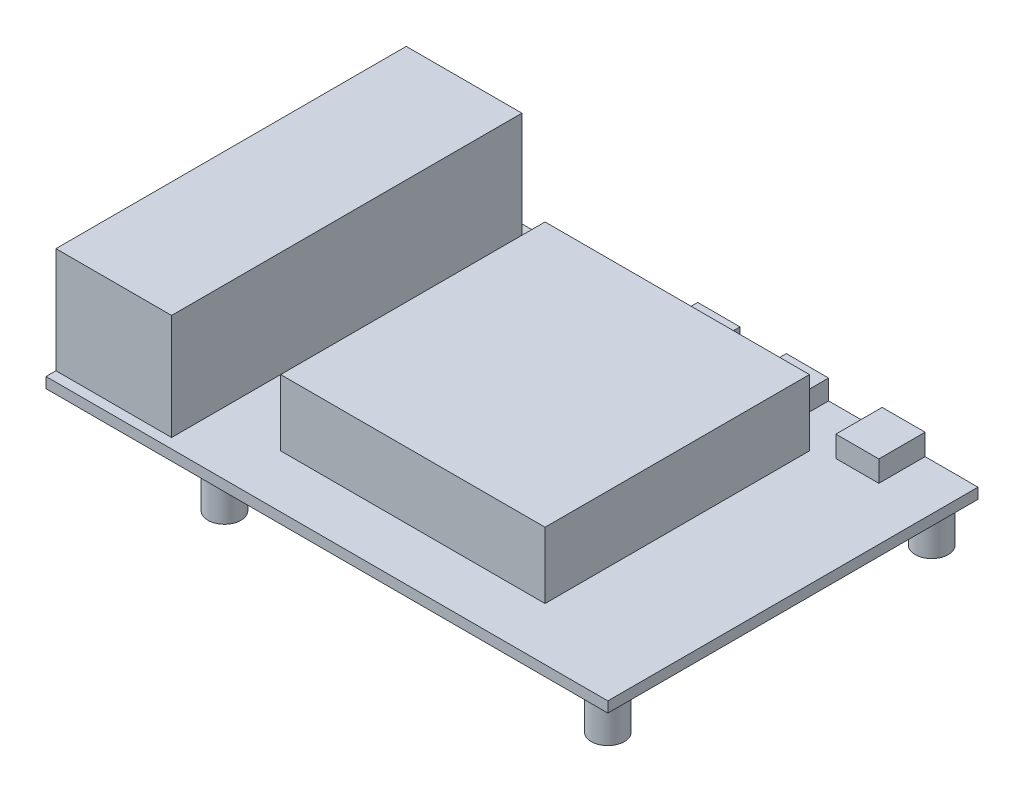
from build123d import *

# Parameters (mm, degrees)
SK_P01_STANDOFF_R        = 2.5
P01_STANDOFF_DEPTH       = 6
SK_P02_STANDOFF_R        = 2.5
P02_STANDOFF_DEPTH       = 6
SK_P03_STANDOFF_R        = 2.5
P03_STANDOFF_DEPTH       = 6
SK_P04_STANDOFF_R        = 2.5
P04_STANDOFF_DEPTH       = 6
P05_BOARD_START          = 6
SK_P05_BOARD_W           = 85
SK_P05_BOARD_H           = 56
P05_BOARD_DEPTH          = 1.6
P06_ACTIVECOOLER_START   = 7.6
SK_P06_ACTIVECOOLER_W    = 40
SK_P06_ACTIVECOOLER_H    = 40
P06_ACTIVECOOLER_DEPTH   = 10
P07_USBANDETHERNET_START = 7.6
SK_P07_USBANDETHERNET_W  = 17.5
SK_P07_USBANDETHERNET_H  = 53
P07_USBANDETHERNET_DEPTH = 16
P08_USBCPOWER_START      = 7.6
SK_P08_USBCPOWER_W       = 6.5
SK_P08_USBCPOWER_H       = 7
P08_USBCPOWER_DEPTH      = 3.2
P09_MICROHDMI0_START     = 7.6
SK_P09_MICROHDMI0_W      = 6.4
SK_P09_MICROHDMI0_H      = 7
P09_MICROHDMI0_DEPTH     = 3
P10_MICROHDMI1_START     = 7.6
SK_P10_MICROHDMI1_W      = 6.4
SK_P10_MICROHDMI1_H      = 7
P10_MICROHDMI1_DEPTH     = 3


with BuildPart() as part:
    # SK_P01_Standoff → P01_Standoff (new body)
    with BuildSketch(Plane(origin=(0, 0, 0), x_dir=(1, 0, 0), z_dir=(0, 1, 0))):
        with Locations(Location((-19, 24.5, 0), (0, 0, 270))):
            Circle(SK_P01_STANDOFF_R)
    extrude(amount=P01_STANDOFF_DEPTH)



with BuildPart() as body_2:
    # SK_P02_Standoff → P02_Standoff (new body)
    with BuildSketch(Plane(origin=(0, 0, 0), x_dir=(1, 0, 0), z_dir=(0, 1, 0))):
        with Locations(Location((-19, -24.5, 0), (0, 0, 270))):
            Circle(SK_P02_STANDOFF_R)
    extrude(amount=P02_STANDOFF_DEPTH)


with BuildPart() as body_3:
    # SK_P03_Standoff → P03_Standoff (new body)
    with BuildSketch(Plane(origin=(0, 0, 0), x_dir=(1, 0, 0), z_dir=(0, 1, 0))):
        with Locations(Location((39, 24.5, 0), (0, 0, 270))):
            Circle(SK_P03_STANDOFF_R)
    extrude(amount=P03_STANDOFF_DEPTH)


with BuildPart() as body_4:
    # SK_P04_Standoff → P04_Standoff (new body)
    with BuildSketch(Plane(origin=(0, 0, 0), x_dir=(1, 0, 0), z_dir=(0, 1, 0))):
        with Locations(Location((39, -24.5, 0), (0, 0, 270))):
            Circle(SK_P04_STANDOFF_R)
    extrude(amount=P04_STANDOFF_DEPTH)


with BuildPart() as part_1:
    add(part.part)

    add(body_2.part)  # P05_Board merges body 2

    add(body_3.part)  # P05_Board merges body 3

    add(body_4.part)  # P05_Board merges body 4
    # SK_P05_Board → P05_Board (add)
    with BuildSketch(Plane(origin=(0, 0, 0), x_dir=(1, 0, 0), z_dir=(0, 1, 0)).offset(P05_BOARD_START)):
        Rectangle(SK_P05_BOARD_W, SK_P05_BOARD_H)
    extrude(amount=P05_BOARD_DEPTH)

    # SK_P06_Activecooler → P06_Activecooler (add)
    with BuildSketch(Plane(origin=(0, 0, 0), x_dir=(1, 0, 0), z_dir=(0, 1, 0)).offset(P06_ACTIVECOOLER_START)):
        with Locations((5, 0)):
            Rectangle(SK_P06_ACTIVECOOLER_W, SK_P06_ACTIVECOOLER_H)
    extrude(amount=P06_ACTIVECOOLER_DEPTH)

    # SK_P07_USBandEthernet → P07_USBandEthernet (add)
    with BuildSketch(Plane(origin=(0, 0, 0), x_dir=(1, 0, 0), z_dir=(0, 1, 0)).offset(P07_USBANDETHERNET_START)):
        with Locations((-33.75, 0)):
            Rectangle(SK_P07_USBANDETHERNET_W, SK_P07_USBANDETHERNET_H)
    extrude(amount=P07_USBANDETHERNET_DEPTH)

    # SK_P08_USBCpower → P08_USBCpower (add)
    with BuildSketch(Plane(origin=(0, 0, 0), x_dir=(1, 0, 0), z_dir=(0, 1, 0)).offset(P08_USBCPOWER_START)):
        with Locations((31.25, 24.5)):
            Rectangle(SK_P08_USBCPOWER_W, SK_P08_USBCPOWER_H)
    extrude(amount=P08_USBCPOWER_DEPTH)

    # SK_P09_microHDMI0 → P09_microHDMI0 (add)
    with BuildSketch(Plane(origin=(0, 0, 0), x_dir=(1, 0, 0), z_dir=(0, 1, 0)).offset(P09_MICROHDMI0_START)):
        with Locations((16.7, 24.5)):
            Rectangle(SK_P09_MICROHDMI0_W, SK_P09_MICROHDMI0_H)
    extrude(amount=P09_MICROHDMI0_DEPTH)

    # SK_P10_microHDMI1 → P10_microHDMI1 (add)
    with BuildSketch(Plane(origin=(0, 0, 0), x_dir=(1, 0, 0), z_dir=(0, 1, 0)).offset(P10_MICROHDMI1_START)):
        with Locations((3.3, 24.5)):
            Rectangle(SK_P10_MICROHDMI1_W, SK_P10_MICROHDMI1_H)
    extrude(amount=P10_MICROHDMI1_DEPTH)


solid = part_1.part
